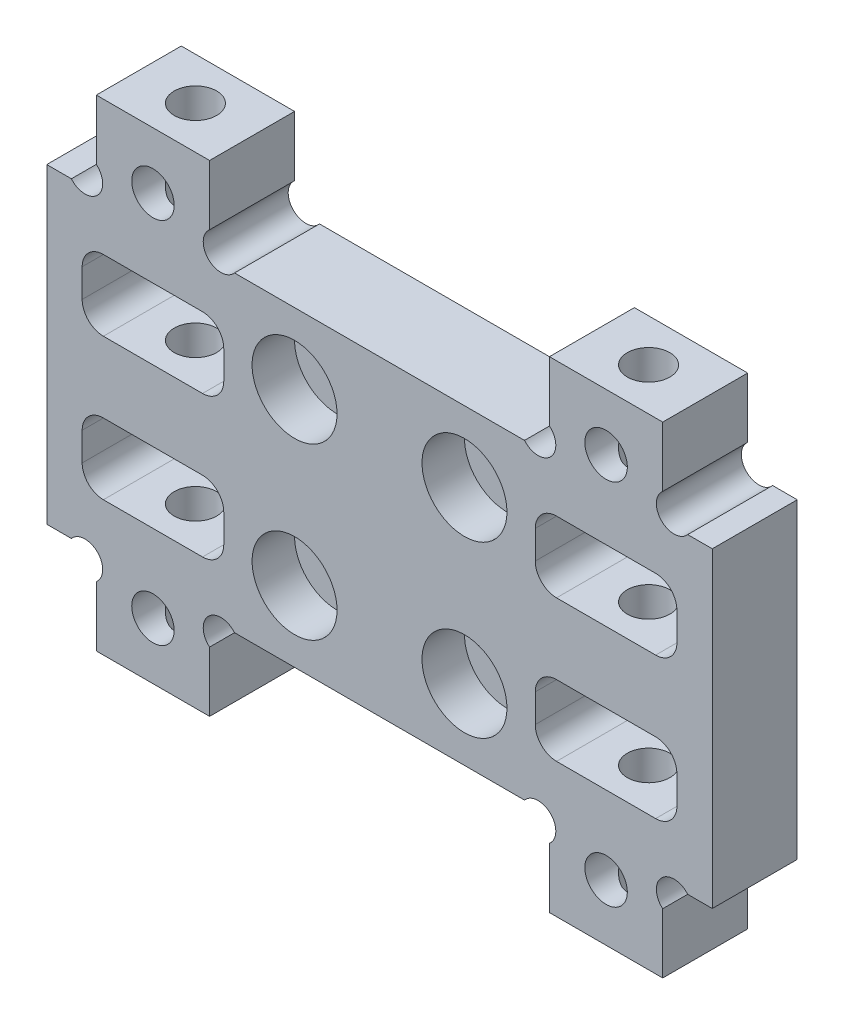
from build123d import *

# Parameters (mm, degrees)
EXTRUDE_1_DEPTH          = 6
CUT_EXTRUDE_1_DEPTH      = 10
CUT_EXTRUDE_1_DEPTH_BACK = 38.043892884
SKETCH_3_R               = 1.5
SKETCH_4_W               = 10
SKETCH_4_H               = 5
CUT_EXTRUDE_2_DEPTH      = 30.618406439
SKETCH_5_R               = 1.5
CUT_EXTRUDE_3_DEPTH      = 30.618406439
FILLET_4_R               = 1.5
SKETCH_9_R               = 1.25
CUT_EXTRUDE_7_DEPTH      = 30.618406439
SKETCH_11_R              = 1.25
CUT_EXTRUDE_9_DEPTH      = 30.618406439
SKETCH_12_R              = 3
CUT_EXTRUDE_10_DEPTH     = 3


with BuildPart() as part:
    # 草图1 → 凸台-拉伸1 (new body)
    with BuildSketch(Plane.XY):
        Polygon((-23.5, 11), (-20, 11), (-20, 17), (-12, 17), (-12, 11), (12, 11), (12, 17), (20, 17), (20, 11), (23.5, 11), (23.5, -11), (20, -11), (20, -17), (12, -17), (12, -11), (-12, -11), (-12, -17), (-20, -17), (-20, -11), (-23.5, -11), align=None)
    extrude(amount=EXTRUDE_1_DEPTH)

    # 草图3 → 切除-拉伸1 (cut, two sides: drawn at the far end of the back side and taken through both)
    with BuildSketch(Plane(origin=(0, 11, 0), x_dir=(1, 0, 0), z_dir=(0, 1, 0)).offset(-CUT_EXTRUDE_1_DEPTH_BACK)):
        with Locations(Location((16, -3, 0), (0, 0, 90))):
            Circle(SKETCH_3_R)
        with Locations(Location((-16, -3, 0), (0, 0, 90))):
            Circle(SKETCH_3_R)
    extrude(amount=CUT_EXTRUDE_1_DEPTH + CUT_EXTRUDE_1_DEPTH_BACK, mode=Mode.SUBTRACT)

    # 草图4 → 切除-拉伸2 (cut, through all)
    with BuildSketch(Plane(origin=(0, 0, 0), x_dir=(-1, 0, 0), z_dir=(0, 0, -1))):
        with Locations((16, 5)):
            Rectangle(SKETCH_4_W, SKETCH_4_H)
        with Locations((16, -5)):
            Rectangle(SKETCH_4_W, SKETCH_4_H)
        with Locations((-16, 5)):
            Rectangle(SKETCH_4_W, SKETCH_4_H)
        with Locations((-16, -5)):
            Rectangle(SKETCH_4_W, SKETCH_4_H)
    extrude(amount=-CUT_EXTRUDE_2_DEPTH, mode=Mode.SUBTRACT)

    # 草图5 → 切除-拉伸3 (cut, through all)
    with BuildSketch(Plane(origin=(0, 0, 0), x_dir=(-1, 0, 0), z_dir=(0, 0, -1))):
        with Locations((-16, 13)):
            Circle(SKETCH_5_R)
        with Locations(Location((16, 13, 0), (0, 0, 180))):
            Circle(SKETCH_5_R)
        with Locations((16, -13)):
            Circle(SKETCH_5_R)
        with Locations(Location((-16, -13, 0), (0, 0, 180))):
            Circle(SKETCH_5_R)
    extrude(amount=-CUT_EXTRUDE_3_DEPTH, mode=Mode.SUBTRACT)

    # 圆角4
    fillet_4_edges = [part.edges().sort_by_distance(p)[0] for p in [
        (21, -7.5, 3),
        (21, -2.5, 3),
        (11, -2.5, 3),
        (11, -7.5, 3),
        (21, 2.5, 3),
        (21, 7.5, 3),
        (11, 7.5, 3),
        (11, 2.5, 3),
        (-11, -7.5, 3),
        (-11, -2.5, 3),
        (-21, -2.5, 3),
        (-21, -7.5, 3),
        (-11, 7.5, 3),
        (-21, 7.5, 3),
        (-21, 2.5, 3),
        (-11, 2.5, 3),
    ]]
    fillet(fillet_4_edges, radius=FILLET_4_R)

    # 草图9 → 切除-拉伸7 (cut, through all)
    with BuildSketch(Plane(origin=(0, 0, 0), x_dir=(-1, 0, 0), z_dir=(0, 0, -1))):
        with Locations((-11.2, 11.8)):
            Circle(SKETCH_9_R)
        with Locations((11.2, 11.8)):
            Circle(SKETCH_9_R)
        with Locations((11.2, -11.8)):
            Circle(SKETCH_9_R)
        with Locations((-11.2, -11.8)):
            Circle(SKETCH_9_R)
        with Locations((-20.8, 11.8)):
            Circle(SKETCH_9_R)
        with Locations((20.8, 11.8)):
            Circle(SKETCH_9_R)
        with Locations((20.8, -11.8)):
            Circle(SKETCH_9_R)
        with Locations((-20.8, -11.8)):
            Circle(SKETCH_9_R)
    extrude(amount=-CUT_EXTRUDE_7_DEPTH, mode=Mode.SUBTRACT)

    # 草图11 → 切除-拉伸9 (cut, through all)
    with BuildSketch(Plane(origin=(0, 0, 0), x_dir=(-1, 0, 0), z_dir=(0, 0, -1))):
        with Locations((6, 6)):
            Circle(SKETCH_11_R)
        with Locations((6, -6)):
            Circle(SKETCH_11_R)
        with Locations(Location((-6, 6, 0), (0, 0, 180))):
            Circle(SKETCH_11_R)
        with Locations(Location((-6, -6, 0), (0, 0, 180))):
            Circle(SKETCH_11_R)
    extrude(amount=-CUT_EXTRUDE_9_DEPTH, mode=Mode.SUBTRACT)

    # 草图12 → 切除-拉伸10 (cut)
    with BuildSketch(Plane.XY.offset(6)):
        with Locations((-6, 6)):
            Circle(SKETCH_12_R)
        with Locations((-6, -6)):
            Circle(SKETCH_12_R)
        with Locations((6, 6)):
            Circle(SKETCH_12_R)
        with Locations((6, -6)):
            Circle(SKETCH_12_R)
    extrude(amount=-CUT_EXTRUDE_10_DEPTH, mode=Mode.SUBTRACT)


solid = part.part
